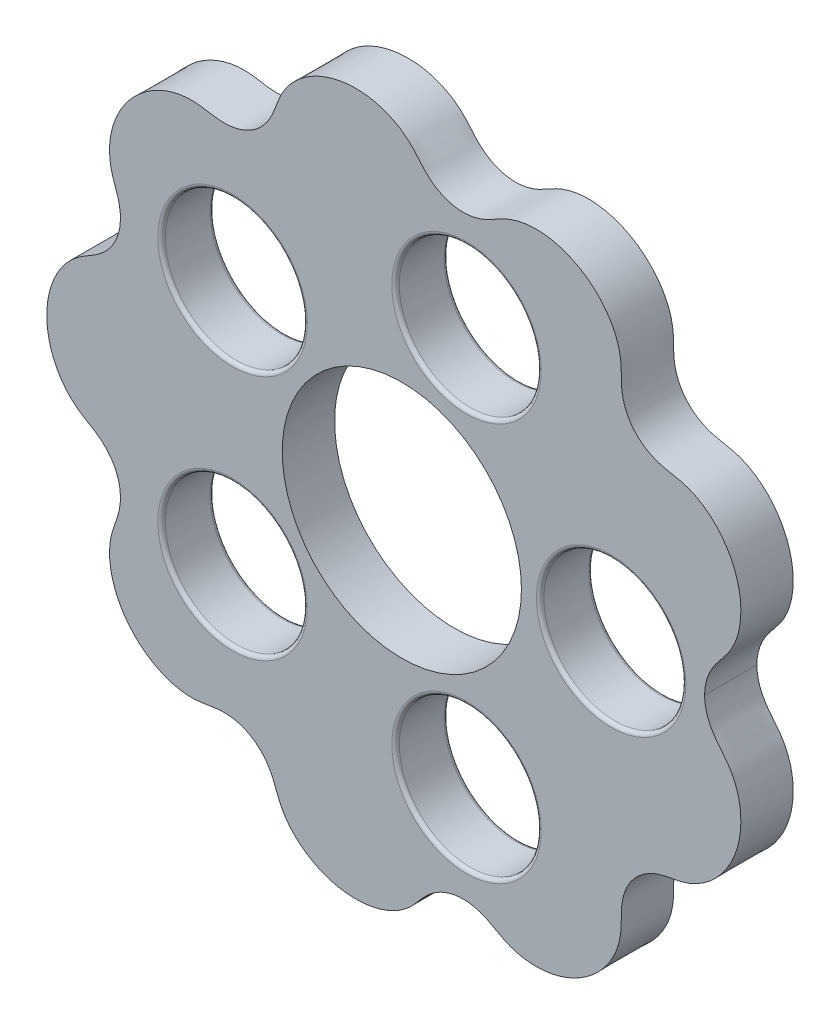
from build123d import *

# Parameters (mm, degrees)
BOSS_EXTRUDE1_DEPTH = 7
SKETCH8_R           = 16
CUT_EXTRUDE2_DEPTH  = 10
SKETCH9_R           = 9.5
CUT_EXTRUDE3_DEPTH  = 68.161031516
FILLET1_R           = 0.5


with BuildPart() as part:
    # Sketch5 → Boss-Extrude1 (new body)
    with BuildSketch(Plane.XY):
        with BuildLine():
            add(Edge.make_bspline(
                [(40.499994625, 0), (40.499995518, -0.266684294), (40.52773534, -0.793136475), (40.650886985, -1.572657112), (40.970306233, -2.571580135), (41.50843288, -3.672428911), (42.324402574, -4.819860106), (43.45807152, -6.04004912), (44.439435201, -7.639513254), (45.078080786, -9.416038217), (45.393497697, -11.353112816), (45.373267308, -13.315298713), (45.010872606, -15.311861151), (44.287862541, -17.27862875), (43.269196746, -19.035986222), (42.008376262, -20.544976656), (40.709412924, -21.646062492), (39.484525583, -22.399914095), (38.383908571, -22.884411169), (37.459914979, -23.176860002), (36.335237397, -23.415497762), (35.199751532, -23.588991856), (34.047811722, -23.905593042), (32.689716924, -24.53454959), (31.410505611, -25.468974783), (30.406144235, -26.709140712), (29.759043994, -28.151884972), (29.423054708, -29.592227306), (29.328666717, -30.974354074), (29.403823634, -32.61762834), (29.122089041, -34.449671912), (28.470271683, -36.208061299), (27.461380532, -37.894986877), (26.180148297, -39.384652691), (24.608046492, -40.684000928), (22.771027749, -41.728064925), (20.841991388, -42.414940738), (18.889199573, -42.749400756), (17.174498486, -42.743288562), (15.745175661, -42.517800313), (14.59211199, -42.167099695), (13.704352424, -41.787797845), (12.708165445, -41.246731939), (11.511385722, -40.526210265), (9.911671205, -39.872493301), (7.884649371, -39.651936498), (6.064624482, -40.026190835), (4.660331179, -40.721191914), (3.501724508, -41.598357554), (2.556191616, -42.58227236), (1.572383828, -43.867959496), (0.20126702, -45.081226061), (-1.407261739, -46.009812665), (-3.238609197, -46.658866645), (-5.152728016, -46.987986408), (-7.161649892, -46.993080247), (-9.206672972, -46.645708491), (-11.110385347, -45.972712851), (-12.823155082, -45.015924582), (-14.349299901, -43.781417578), (-15.565246835, -42.357464096), (-16.462001763, -40.738038079), (-16.955600959, -39.170934727), (-17.509564742, -37.904094719), (-18.169591031, -36.883077852), (-18.855856157, -36.09509583), (-19.858182479, -35.247252743), (-21.252255505, -34.492647823), (-22.766326497, -34.12754456), (-24.268497138, -34.129701285), (-25.44830334, -34.293990179), (-26.321572919, -34.455924641), (-27.241328175, -34.588048158), (-28.210820898, -34.632858707), (-29.412764481, -34.557770636), (-30.824421879, -34.272032778), (-32.42538719, -33.684673097), (-34.13074136, -32.700054029), (-35.695776217, -31.396091088), (-37.055439146, -29.790068621), (-38.083201208, -28.031664869), (-38.774625213, -26.188719987), (-39.140377513, -24.254381238), (-39.145629105, -22.375576825), (-38.774309432, -20.556807308), (-38.138130209, -19.037003382), (-37.760801159, -17.701163307), (-37.591969731, -16.229400002), (-37.718368555, -14.64579196), (-38.253772019, -13.131804153), (-39.156521127, -11.81515909), (-40.231243544, -10.769825261), (-41.384359808, -9.967597164), (-42.630177336, -9.328479676), (-43.767711357, -8.503136628), (-44.623168554, -7.677506936), (-45.251241992, -6.928861107), (-45.78204856, -6.159518806), (-46.225254838, -5.383840677), (-46.621111426, -4.537166174), (-46.958906853, -3.620940704), (-47.227025794, -2.638724202), (-47.413996056, -1.593023166), (-47.484300128, -0.798816017), (-47.499999364, -0.267115997), (-47.499999717, 0)],
                knots=[0.123609768, 0.123609768, 0.123609768, 0.123609768, 0.123609768, 0.128752904, 0.133762247, 0.138765168, 0.143768089, 0.152291759, 0.160815429, 0.170819477, 0.179646988, 0.188474498, 0.19847848, 0.208482463, 0.218584235, 0.228686007, 0.237452572, 0.246219137, 0.251269733, 0.256320329, 0.260596294, 0.26487226, 0.27342419, 0.278471843, 0.283519496, 0.293637141, 0.303707985, 0.308734791, 0.313761597, 0.322051709, 0.330341821, 0.340399454, 0.349200417, 0.35800138, 0.368058431, 0.378115482, 0.388331829, 0.398548177, 0.407341236, 0.416134295, 0.421241664, 0.426349034, 0.430533382, 0.43471773, 0.443086427, 0.453298295, 0.463530371, 0.473409312, 0.478339764, 0.483270216, 0.491457296, 0.499644375, 0.509507824, 0.518285555, 0.527063286, 0.536927766, 0.546792246, 0.556835031, 0.566877816, 0.575666219, 0.584454622, 0.594498527, 0.602777755, 0.611056983, 0.616075706, 0.621094429, 0.626122573, 0.631150717, 0.641282486, 0.65139019, 0.655672743, 0.659955296, 0.664237849, 0.668520402, 0.673577871, 0.678635341, 0.687414317, 0.696193292, 0.706309278, 0.716425263, 0.726499037, 0.736572811, 0.745388429, 0.754204047, 0.764277937, 0.772581173, 0.780884409, 0.785920365, 0.79095632, 0.801044174, 0.811264489, 0.81636783, 0.821471171, 0.82985386, 0.838236548, 0.843339365, 0.848442182, 0.852743673, 0.857045164, 0.861346654, 0.865648145, 0.87075068, 0.875853214, 0.880955748, 0.886107098, 0.886107098, 0.886107098, 0.886107098, 0.886107098], degree=4))
            add(Edge.make_bspline(
                [(40.499994625, 0), (40.499995383, 0.266684294), (40.527735205, 0.793136475), (40.65088685, 1.572657112), (40.970306098, 2.571580135), (41.508432745, 3.672428911), (42.324402439, 4.819860106), (43.458071385, 6.04004912), (44.439435066, 7.639513254), (45.078080651, 9.416038217), (45.393497562, 11.353112816), (45.373267172, 13.315298713), (45.010872471, 15.311861151), (44.287862406, 17.27862875), (43.26919661, 19.035986222), (42.008376127, 20.544976656), (40.709412789, 21.646062492), (39.484525448, 22.399914095), (38.383908435, 22.884411169), (37.459914843, 23.176860002), (36.335237262, 23.415497762), (35.199751396, 23.588991856), (34.047811587, 23.905593042), (32.689716788, 24.53454959), (31.410505476, 25.468974783), (30.4061441, 26.709140712), (29.759043858, 28.151884972), (29.423054572, 29.592227306), (29.328666582, 30.974354074), (29.403823499, 32.61762834), (29.122088905, 34.449671912), (28.470271548, 36.208061299), (27.461380396, 37.894986877), (26.180148162, 39.384652691), (24.608046356, 40.684000928), (22.771027613, 41.728064925), (20.841991252, 42.414940738), (18.889199438, 42.749400756), (17.174498351, 42.743288562), (15.745175526, 42.517800313), (14.592111855, 42.167099695), (13.704352289, 41.787797845), (12.70816531, 41.246731939), (11.511385586, 40.526210265), (9.91167107, 39.8724933), (7.884649236, 39.651936498), (6.064624347, 40.026190835), (4.660331044, 40.721191914), (3.501724373, 41.598357554), (2.55619148, 42.58227236), (1.572383693, 43.867959496), (0.201266885, 45.081226061), (-1.407261874, 46.009812665), (-3.238609333, 46.658866645), (-5.152728151, 46.987986408), (-7.161650028, 46.993080247), (-9.206673107, 46.645708491), (-11.110385482, 45.972712851), (-12.823155217, 45.015924582), (-14.349300037, 43.781417578), (-15.565246971, 42.357464096), (-16.462001898, 40.738038079), (-16.955601095, 39.170934727), (-17.509564877, 37.904094719), (-18.169591166, 36.883077852), (-18.855856293, 36.09509583), (-19.858182614, 35.247252743), (-21.25225564, 34.492647823), (-22.766326633, 34.12754456), (-24.268497273, 34.129701285), (-25.448303476, 34.293990179), (-26.321573054, 34.455924641), (-27.241328311, 34.588048158), (-28.210821034, 34.632858707), (-29.412764616, 34.557770636), (-30.824422014, 34.272032778), (-32.425387325, 33.684673097), (-34.130741495, 32.700054029), (-35.695776352, 31.396091088), (-37.055439281, 29.790068621), (-38.083201344, 28.031664869), (-38.774625349, 26.188719987), (-39.140377649, 24.254381238), (-39.145629241, 22.375576825), (-38.774309567, 20.556807308), (-38.138130344, 19.037003381), (-37.760801295, 17.701163307), (-37.591969866, 16.229400002), (-37.71836869, 14.64579196), (-38.253772154, 13.131804153), (-39.156521262, 11.81515909), (-40.23124368, 10.769825261), (-41.384359943, 9.967597164), (-42.630177472, 9.328479676), (-43.767711492, 8.503136627), (-44.62316869, 7.677506936), (-45.251242128, 6.928861107), (-45.782048696, 6.159518806), (-46.225254973, 5.383840677), (-46.621111561, 4.537166174), (-46.958906989, 3.620940704), (-47.227025929, 2.638724202), (-47.413996191, 1.593023166), (-47.484300263, 0.798816017), (-47.4999995, 0.267115997), (-47.499999717, 0)],
                knots=[0.123609768, 0.123609768, 0.123609768, 0.123609768, 0.123609768, 0.128752904, 0.133762247, 0.138765168, 0.143768089, 0.152291759, 0.160815429, 0.170819477, 0.179646988, 0.188474498, 0.19847848, 0.208482463, 0.218584235, 0.228686007, 0.237452572, 0.246219137, 0.251269733, 0.256320329, 0.260596294, 0.26487226, 0.27342419, 0.278471843, 0.283519496, 0.293637141, 0.303707985, 0.308734791, 0.313761597, 0.322051709, 0.330341821, 0.340399454, 0.349200417, 0.35800138, 0.368058431, 0.378115482, 0.388331829, 0.398548177, 0.407341236, 0.416134295, 0.421241664, 0.426349034, 0.430533382, 0.43471773, 0.443086427, 0.453298295, 0.463530371, 0.473409312, 0.478339764, 0.483270216, 0.491457296, 0.499644375, 0.509507824, 0.518285555, 0.527063286, 0.536927766, 0.546792246, 0.556835031, 0.566877816, 0.575666219, 0.584454622, 0.594498527, 0.602777755, 0.611056983, 0.616075706, 0.621094429, 0.626122573, 0.631150717, 0.641282486, 0.65139019, 0.655672743, 0.659955296, 0.664237849, 0.668520402, 0.673577871, 0.678635341, 0.687414317, 0.696193292, 0.706309278, 0.716425263, 0.726499037, 0.736572811, 0.745388429, 0.754204047, 0.764277937, 0.772581173, 0.780884409, 0.785920365, 0.79095632, 0.801044174, 0.811264489, 0.81636783, 0.821471171, 0.82985386, 0.838236548, 0.843339365, 0.848442182, 0.852743673, 0.857045164, 0.861346654, 0.865648145, 0.87075068, 0.875853214, 0.880955748, 0.886107098, 0.886107098, 0.886107098, 0.886107098, 0.886107098], degree=4))
        make_face()
    extrude(amount=BOSS_EXTRUDE1_DEPTH)

    # Sketch8 → Cut-Extrude2 (cut)
    with BuildSketch(Plane.XY.offset(7)):
        Circle(SKETCH8_R)
    extrude(amount=-CUT_EXTRUDE2_DEPTH, mode=Mode.SUBTRACT)

    # Sketch9 → Cut-Extrude3 (cut, through all)
    with BuildSketch(Plane.XY.offset(7)):
        with Locations((-22.652475842, -16.457987064)):
            Circle(SKETCH9_R)
        with Locations((-22.652475842, 16.457987064)):
            Circle(SKETCH9_R)
        with Locations((8.652475842, 26.629582456)):
            Circle(SKETCH9_R)
        with Locations((28, 0)):
            Circle(SKETCH9_R)
        with Locations((8.652475842, -26.629582456)):
            Circle(SKETCH9_R)
    extrude(amount=-CUT_EXTRUDE3_DEPTH, mode=Mode.SUBTRACT)

    # Fillet1
    fillet1_edges = [part.edges().sort_by_distance(p)[0] for p in [
        (-32.152475842, 16.457987064, 0),
        (-32.152475842, 16.457987064, 7),
        (-0.847524158, 26.629582456, 0),
        (-0.847524158, 26.629582456, 7),
        (18.5, 0, 0),
        (18.5, 0, 7),
        (-0.847524158, -26.629582456, 0),
        (-0.847524158, -26.629582456, 7),
        (-32.152475842, -16.457987064, 0),
        (-32.152475842, -16.457987064, 7),
    ]]
    fillet(fillet1_edges, radius=FILLET1_R)


solid = part.part
